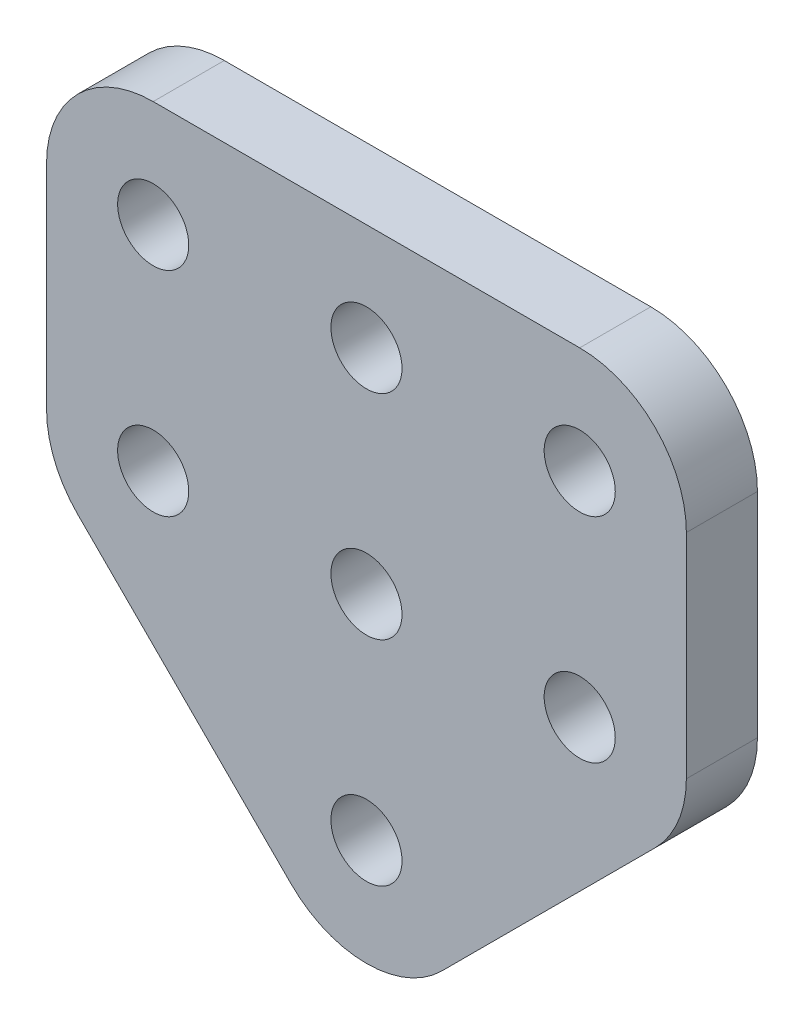
from build123d import *

# Parameters (mm, degrees)
MODEL_R                 = 1.5
SALIENTE_EXTRUIR1_DEPTH = 3


with BuildPart() as part:
    # Model → Saliente-Extruir1 (new body)
    with BuildSketch(Plane.XY):
        with BuildLine():
            Line((174.227054575, 213.178720063), (174.227054575, 204.178720063))
            ThreePointArc((174.227054575, 204.178720063), (174.569596678, 202.456644617), (175.545074059, 200.996739548))
            Line((175.545074059, 200.996739548), (184.545074059, 191.996739548))
            ThreePointArc((184.545074059, 191.996739548), (187.727054575, 190.678720063), (190.90903509, 191.996739548))
            Line((190.90903509, 191.996739548), (199.90903509, 200.996739548))
            ThreePointArc((199.90903509, 200.996739548), (200.884512471, 202.456644617), (201.227054575, 204.178720063))
            Line((201.227054575, 204.178720063), (201.227054575, 213.178720063))
            ThreePointArc((201.227054575, 213.178720063), (199.90903509, 216.360700578), (196.727054575, 217.678720063))
            Line((196.727054575, 217.678720063), (178.727054575, 217.678720063))
            ThreePointArc((178.727054575, 217.678720063), (175.545074059, 216.360700578), (174.227054575, 213.178720063))
        make_face()
        with Locations((187.727054575, 204.178720063)):
            Circle(MODEL_R, mode=Mode.SUBTRACT)
        with Locations((178.727054575, 204.178720063)):
            Circle(MODEL_R, mode=Mode.SUBTRACT)
        with Locations((187.727054575, 213.178720063)):
            Circle(MODEL_R, mode=Mode.SUBTRACT)
        with Locations((178.727054575, 213.178720063)):
            Circle(MODEL_R, mode=Mode.SUBTRACT)
        with Locations((196.727054575, 213.178720063)):
            Circle(MODEL_R, mode=Mode.SUBTRACT)
        with Locations((187.727054575, 195.178720063)):
            Circle(MODEL_R, mode=Mode.SUBTRACT)
        with Locations((196.727054575, 204.178720063)):
            Circle(MODEL_R, mode=Mode.SUBTRACT)
    extrude(amount=SALIENTE_EXTRUIR1_DEPTH)


solid = part.part
